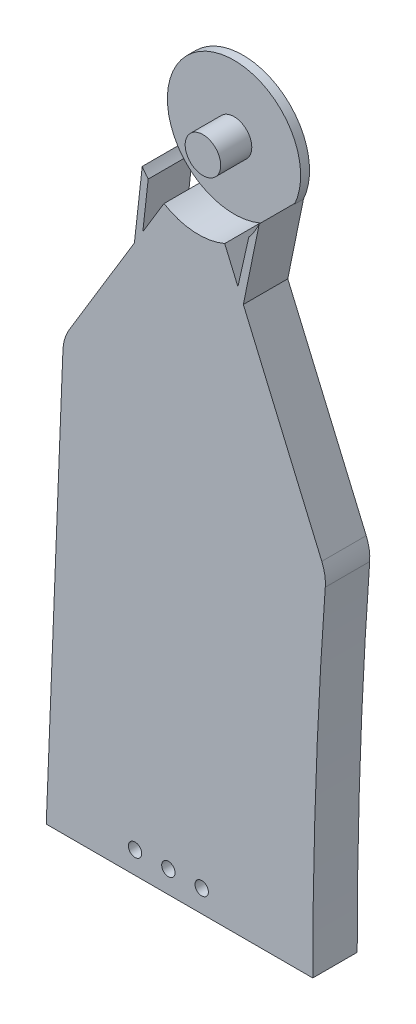
from build123d import *

# Parameters (mm, degrees)
BOSS_EXTRUDE1_DEPTH = 10
CUT_EXTRUDE2_DEPTH  = 10
BOSS_EXTRUDE2_DEPTH = 10
SKETCH7_R           = 15
CUT_EXTRUDE3_DEPTH  = 17
SKETCH8_R           = 15
BOSS_EXTRUDE4_DEPTH = 2
SKETCH10_R          = 4
BOSS_EXTRUDE5_DEPTH = 7
FILLET1_R           = 10
CUT_EXTRUDE4_DEPTH  = 10
FILLET2_R           = 10
SKETCH12_W          = 25
SKETCH12_H          = 10
CUT_EXTRUDE5_DEPTH  = 5
SKETCH13_R          = 1.505
CUT_EXTRUDE6_DEPTH  = 15
BOSS_EXTRUDE6_DEPTH = 10


with BuildPart() as part:
    # Sketch2 → Boss-Extrude1 (new body)
    with BuildSketch(Plane.XY):
        with BuildLine():
            Line((0, 0), (70, 0))
            ThreePointArc((70, 0), (80.047115298, 146.372811683), (110, 290))
            Line((110, 290), (50, 290))
            ThreePointArc((50, 290), (12.591539765, 147.139389696), (0, 0))
        make_face()
    extrude(amount=BOSS_EXTRUDE1_DEPTH)

    # Sketch5 → Cut-Extrude2 (cut)
    with BuildSketch(Plane.XY.offset(10)):
        Polygon((-13.167731947, 80), (152.833861951, 80), (152.833861951, 337.050867126), (18.976855574, 332.054655913), align=None)
    extrude(amount=-CUT_EXTRUDE2_DEPTH, mode=Mode.SUBTRACT)

    # Sketch6 → Boss-Extrude2 (add)
    with BuildSketch(Plane.XY.offset(10)):
        Polygon((72.991341013, 80), (3.703067383, 80), (44.276364493, 147.051943441), align=None)
    extrude(amount=-BOSS_EXTRUDE2_DEPTH)

    # Sketch7 → Cut-Extrude3 (cut)
    with BuildSketch(Plane(origin=(0, 0, 0), x_dir=(-1, 0, 0), z_dir=(0, 0, -1))):
        with Locations((-44.276364493, 147.051943441)):
            Circle(SKETCH7_R)
    extrude(amount=-CUT_EXTRUDE3_DEPTH, mode=Mode.SUBTRACT)

    # Fillet1
    fillet1_edges = [part.edges().sort_by_distance(p)[0] for p in [
        (3.703067383, 80, 5),
        (72.991341013, 80, 5),
    ]]
    fillet(fillet1_edges, radius=FILLET1_R)

    # Sketch11 → Cut-Extrude4 (cut)
    with BuildSketch(Plane.XY.offset(10)):
        Polygon((13.865882816, 96.79519719), (9.525195507, -12.111976015), (-19.82973313, -10.941983603), (-15.53567793, 96.79519719), align=None)
    extrude(amount=-CUT_EXTRUDE4_DEPTH, mode=Mode.SUBTRACT)

    # Fillet2
    fillet2_edges = [part.edges().sort_by_distance(p)[0] for p in [
        (13.865882816, 96.79519719, 5),
    ]]
    fillet(fillet2_edges, radius=FILLET2_R)

    # Sketch12 → Cut-Extrude5 (cut)
    with BuildSketch(Plane(origin=(0, 0, 0), x_dir=(-1, 0, 0), z_dir=(0, 0, -1))):
        with Locations((-37.5, 5)):
            Rectangle(SKETCH12_W, SKETCH12_H)
    extrude(amount=-CUT_EXTRUDE5_DEPTH, mode=Mode.SUBTRACT)

    # Sketch13 → Cut-Extrude6 (cut)
    with BuildSketch(Plane(origin=(0, 0, 5), x_dir=(-1, 0, 0), z_dir=(0, 0, -1))):
        with Locations((-45, 5)):
            Circle(SKETCH13_R)
        with Locations((-37.5, 5)):
            Circle(SKETCH13_R)
        with Locations((-30, 5)):
            Circle(SKETCH13_R)
    extrude(amount=-CUT_EXTRUDE6_DEPTH, mode=Mode.SUBTRACT)



with BuildPart() as body_2:
    # Sketch8 → Boss-Extrude4 (new body)
    with BuildSketch(Plane(origin=(0, 0, 0), x_dir=(-1, 0, 0), z_dir=(0, 0, -1))):
        with Locations((-44.276364493, 147.051943441)):
            Circle(SKETCH8_R)
    extrude(amount=-BOSS_EXTRUDE4_DEPTH)

    # Sketch10 → Boss-Extrude5 (add)
    with BuildSketch(Plane.XY.offset(2)):
        with Locations((44.276364493, 147.051943441)):
            Circle(SKETCH10_R)
    extrude(amount=BOSS_EXTRUDE5_DEPTH)


with BuildPart() as part_1:
    add(part.part)

    add(body_2.part)  # Boss-Extrude6 merges body 2
    # Sketch14 → Boss-Extrude6 (add)
    with BuildSketch(Plane(origin=(0, 0, 0), x_dir=(-1, 0, 0), z_dir=(0, 0, -1))):
        with BuildLine():
            Line((-53.147136244, 126.337927349), (-55.598718025, 137.213025284))
            ThreePointArc((-55.598718025, 137.213025284), (-56.912855269, 139.008842213), (-57.946701254, 140.97939483))
            Line((-57.946701254, 140.97939483), (-54.372927134, 123.47560004))
            Line((-54.372927134, 123.47560004), (-53.147136244, 126.337927349))
        make_face()
        with BuildLine():
            ThreePointArc((-31.612557589, 139.012789587), (-32.24957103, 138.087779286), (-32.954010961, 137.213025284))
            Line((-32.954010961, 137.213025284), (-31.742262033, 126.337927349))
            Line((-31.742262033, 126.337927349), (-29.852240994, 123.214454699))
            Line((-29.852240994, 123.214454699), (-31.612557589, 139.012789587))
        make_face()
    extrude(amount=-BOSS_EXTRUDE6_DEPTH)


solid = part_1.part
